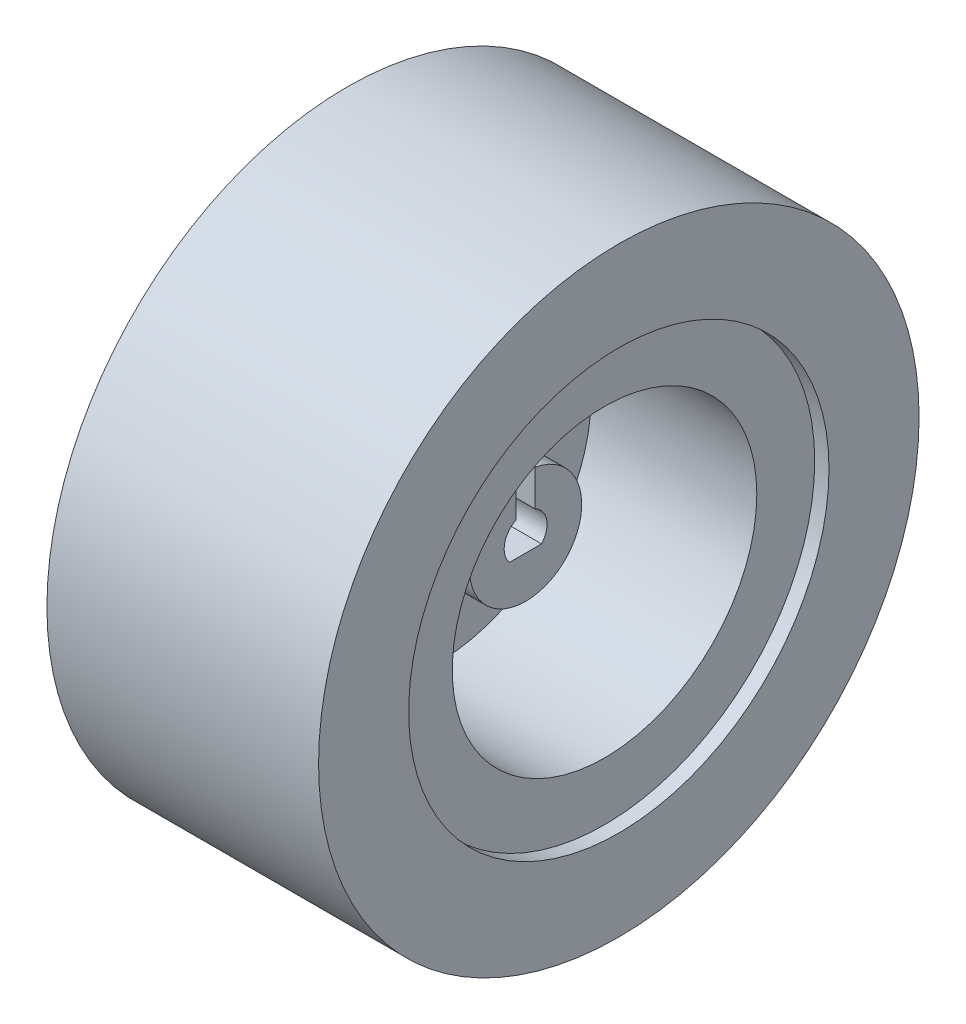
from build123d import *

# Parameters (mm, degrees)
BOSS_EXTRUDE1_DEPTH      = 9.5
BOSS_EXTRUDE1_DEPTH_BACK = 9.5
SKETCH1_R                = 21
SKETCH5_R                = 14.7
CUT_EXTRUDE3_DEPTH       = 1
SKETCH6_R                = 10.65
CUT_EXTRUDE4_DEPTH       = 11.6
SKETCH7_R                = 3.925
BOSS_EXTRUDE2_DEPTH      = 6.08
CUT_EXTRUDE1_DEPTH       = 36.256205128
CUT_EXTRUDE2_START       = -4.5
SKETCH4_R                = 14.7
CUT_EXTRUDE2_DEPTH       = 4.5


with BuildPart() as part:
    # Sketch1 → Boss-Extrude1 (new, two sides: drawn at the far end of the back side and taken through both)
    with BuildSketch(Plane(origin=(0, 0, 0), x_dir=(0, 0, -1), z_dir=(1, 0, 0)).offset(-BOSS_EXTRUDE1_DEPTH_BACK)):
        Circle(SKETCH1_R)
    extrude(amount=BOSS_EXTRUDE1_DEPTH + BOSS_EXTRUDE1_DEPTH_BACK)

    # Sketch5 → Cut-Extrude3 (cut)
    with BuildSketch(Plane(origin=(9.5, 0, 0), x_dir=(0, 0, -1), z_dir=(1, 0, 0))):
        Circle(SKETCH5_R)
    extrude(amount=-CUT_EXTRUDE3_DEPTH, mode=Mode.SUBTRACT)

    # Sketch6 → Cut-Extrude4 (cut)
    with BuildSketch(Plane(origin=(8.5, 0, 0), x_dir=(0, 0, -1), z_dir=(1, 0, 0))):
        Circle(SKETCH6_R)
    extrude(amount=-CUT_EXTRUDE4_DEPTH, mode=Mode.SUBTRACT)

    # Sketch7 → Boss-Extrude2 (add)
    with BuildSketch(Plane(origin=(-3.1, 0, 0), x_dir=(0, 0, -1), z_dir=(1, 0, 0))):
        Circle(SKETCH7_R)
    extrude(amount=BOSS_EXTRUDE2_DEPTH)

    # Sketch2 → Cut-Extrude1 (cut, through all)
    with BuildSketch(Plane(origin=(9.5, 0, 0), x_dir=(0, 0, -1), z_dir=(1, 0, 0))):
        with BuildLine():
            Line((-1.118033989, -1), (1.118033989, -1))
            ThreePointArc((1.118033989, -1), (1.472757251, 0.284580535), (0.665, 1.344535236))
            Line((0.665, 1.344535236), (0.665, 8.879705587))
            Line((0.665, 8.879705587), (-0.665, 8.879705587))
            Line((-0.665, 8.879705587), (-0.665, 1.344535236))
            ThreePointArc((-0.665, 1.344535236), (-1.472757251, 0.284580535), (-1.118033989, -1))
        make_face()
    extrude(amount=-CUT_EXTRUDE1_DEPTH, mode=Mode.SUBTRACT)

    # Sketch4 → Cut-Extrude2 (cut)
    with BuildSketch(Plane.ZY.offset(9.5).offset(CUT_EXTRUDE2_START)):
        Circle(SKETCH4_R)
    extrude(amount=CUT_EXTRUDE2_DEPTH, mode=Mode.SUBTRACT)


solid = part.part
